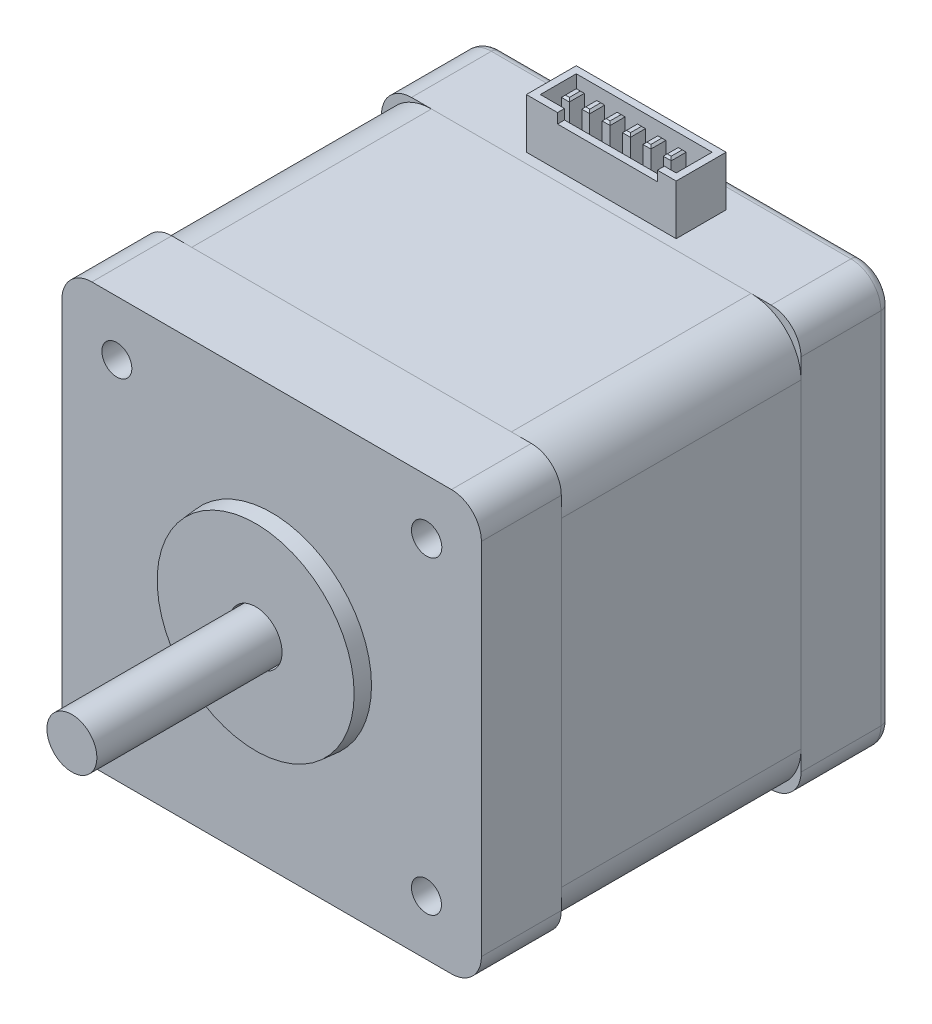
from build123d import *

# Parameters (mm, degrees)
SKETCH_1_R          = 1.5
EXTRUDE_1_DEPTH     = 8
SKETCH_4_R          = 2.5
EXTRUDE_2_DEPTH     = 20
SKETCH_9_W          = 42
SKETCH_9_H          = 42
EXTRUDE_7_DEPTH     = 24
SKETCH_10_W         = 42
SKETCH_10_H         = 42
EXTRUDE_8_DEPTH     = 9
FILLET_1_R          = 3
FILLET_2_R          = 5
SKETCH_12_R         = 1.5
SKETCH_12_R_2       = 1.518540069
CUT_EXTRUDE_1_DEPTH = 51.626080235
SKETCH_14_W         = 15
SKETCH_14_H         = 5
SKETCH_14_W_2       = 13.6
SKETCH_14_H_2       = 3.6
SKETCH_14_W_3       = 0.8
SKETCH_14_H_3       = 1.5
EXTRUDE_10_DEPTH    = 5
CHAMFER_1_SIZE      = 0.2
SKETCH_15_W         = 10
SKETCH_15_H         = 1
CUT_EXTRUDE_2_DEPTH = 0.7
FILLET_3_R          = 1
SKETCH_16_R         = 10
SKETCH_16_R_2       = 2.5
EXTRUDE_11_DEPTH    = 1.6
EXTRUDE_11_DRAFT    = 5
SKETCH_18_R         = 5
CUT_EXTRUDE_3_DEPTH = 3
EXTRUDE_START       = 2
SKETCH_19_R         = 2.5
EXTRUDE_13_DEPTH    = 2


with BuildPart() as part:
    # 草图1 → 凸台-拉伸1 (new body)
    with BuildSketch(Plane.XY):
        with BuildLine():
            Line((-18, 21), (18, 21))
            ThreePointArc((18, 21), (20.121320344, 20.121320344), (21, 18))
            Line((21, 18), (21, -18))
            ThreePointArc((21, -18), (20.121320344, -20.121320344), (18, -21))
            Line((18, -21), (-18, -21))
            ThreePointArc((-18, -21), (-20.121320344, -20.121320344), (-21, -18))
            Line((-21, -18), (-21, 18))
            ThreePointArc((-21, 18), (-20.121320344, 20.121320344), (-18, 21))
        make_face()
        with Locations((-15.5, 15.5)):
            Circle(SKETCH_1_R, mode=Mode.SUBTRACT)
        with Locations(Location((15.5, 15.5, 0), (0, 0, 180))):
            Circle(SKETCH_1_R, mode=Mode.SUBTRACT)
        with Locations((15.5, -15.5)):
            Circle(SKETCH_1_R, mode=Mode.SUBTRACT)
        with Locations(Location((-15.5, -15.5, 0), (0, 0, 180))):
            Circle(SKETCH_1_R, mode=Mode.SUBTRACT)
    extrude(amount=EXTRUDE_1_DEPTH)

    # 草图4 → 凸台-拉伸2 (add)
    with BuildSketch(Plane.XY.offset(8)):
        with Locations(Location((0, 0, 0), (0, 0, 180))):
            Circle(SKETCH_4_R)
    extrude(amount=EXTRUDE_2_DEPTH)


with BuildPart() as body_2:
    # 草图9 → 凸台-拉伸7 (new body)
    with BuildSketch(Plane(origin=(0, 0, 0), x_dir=(-1, 0, 0), z_dir=(0, 0, -1))):
        Rectangle(SKETCH_9_W, SKETCH_9_H)
    extrude(amount=EXTRUDE_7_DEPTH)

    # 圆角2
    fillet_2_edges = [body_2.edges().sort_by_distance(p)[0] for p in [
        (-21, -21, -12),
        (21, -21, -12),
        (21, 21, -12),
        (-21, 21, -12),
    ]]
    fillet(fillet_2_edges, radius=FILLET_2_R)


with BuildPart() as body_3:
    # 草图10 → 凸台-拉伸8 (new body)
    with BuildSketch(Plane(origin=(0, 0, -24), x_dir=(-1, 0, 0), z_dir=(0, 0, -1))):
        Rectangle(SKETCH_10_W, SKETCH_10_H)
    extrude(amount=EXTRUDE_8_DEPTH)

    # 圆角1
    fillet_1_edges = [body_3.edges().sort_by_distance(p)[0] for p in [
        (21, 21, -28.5),
        (-21, 21, -28.5),
        (-21, -21, -28.5),
        (21, -21, -28.5),
    ]]
    fillet(fillet_1_edges, radius=FILLET_1_R)


with BuildPart() as cut_extrude_1_tool:
    # 草图12 → 切除-拉伸1 (new, through all)
    with BuildSketch(Plane.XY.offset(8)):
        with Locations((-15.5, 15.5)):
            Circle(SKETCH_12_R)
        with Locations((15.518540069, 15.5)):
            Circle(SKETCH_12_R_2)
        with Locations((-15.5, -15.5)):
            Circle(SKETCH_12_R)
        with Locations((15.5, -15.5)):
            Circle(SKETCH_12_R)
    extrude(amount=-CUT_EXTRUDE_1_DEPTH)


with BuildPart() as part_1:
    add(part.part)

    # 切除-拉伸1: cut by cut_extrude_1_tool
    add(cut_extrude_1_tool.part, mode=Mode.SUBTRACT)


with BuildPart() as body_2_1:
    add(body_2.part)

    # 切除-拉伸1: cut by cut_extrude_1_tool
    add(cut_extrude_1_tool.part, mode=Mode.SUBTRACT)


with BuildPart() as body_3_1:
    add(body_3.part)

    # 切除-拉伸1: cut by cut_extrude_1_tool
    add(cut_extrude_1_tool.part, mode=Mode.SUBTRACT)

    # 草图14 → 凸台-拉伸10 (add)
    # profile 1 of 7: a face of its own
    with BuildSketch(Plane(origin=(0, 21, 0), x_dir=(1, 0, 0), z_dir=(0, 1, 0))):
        with Locations((0, 27.5)):
            Rectangle(SKETCH_14_W, SKETCH_14_H)
        with Locations((0, 27.5)):
            Rectangle(SKETCH_14_W_2, SKETCH_14_H_2, mode=Mode.SUBTRACT)
    # profile 2 of 7: a face of its own
    with BuildSketch(Plane(origin=(0, 21, 0), x_dir=(1, 0, 0), z_dir=(0, 1, 0))):
        with Locations((-5.3, 27.457329348)):
            Rectangle(SKETCH_14_W_3, SKETCH_14_H_3)
    # profile 3 of 7: a face of its own
    with BuildSketch(Plane(origin=(0, 21, 0), x_dir=(1, 0, 0), z_dir=(0, 1, 0))):
        with Locations((-1.22, 27.457329348)):
            Rectangle(SKETCH_14_W_3, SKETCH_14_H_3)
    # profile 4 of 7: a face of its own
    with BuildSketch(Plane(origin=(0, 21, 0), x_dir=(1, 0, 0), z_dir=(0, 1, 0))):
        with Locations((4.9, 27.457329348)):
            Rectangle(SKETCH_14_W_3, SKETCH_14_H_3)
    # profile 5 of 7: a face of its own
    with BuildSketch(Plane(origin=(0, 21, 0), x_dir=(1, 0, 0), z_dir=(0, 1, 0))):
        with Locations((2.86, 27.457329348)):
            Rectangle(SKETCH_14_W_3, SKETCH_14_H_3)
    # profile 6 of 7: a face of its own
    with BuildSketch(Plane(origin=(0, 21, 0), x_dir=(1, 0, 0), z_dir=(0, 1, 0))):
        with Locations((-3.26, 27.457329348)):
            Rectangle(SKETCH_14_W_3, SKETCH_14_H_3)
    # profile 7 of 7: a face of its own
    with BuildSketch(Plane(origin=(0, 21, 0), x_dir=(1, 0, 0), z_dir=(0, 1, 0))):
        with Locations((0.82, 27.457329348)):
            Rectangle(SKETCH_14_W_3, SKETCH_14_H_3)
    extrude(amount=EXTRUDE_10_DEPTH)

    # 倒角1
    chamfer_1_edges = [body_3_1.edges().sort_by_distance(p)[0] for p in [
        (5.3, 26, -27.457329348),
        (4.9, 26, -28.207329348),
        (4.5, 26, -27.457329348),
        (4.9, 26, -26.707329348),
        (3.26, 26, -27.457329348),
        (2.86, 26, -28.207329348),
        (2.46, 26, -27.457329348),
        (2.86, 26, -26.707329348),
        (-2.86, 26, -27.457329348),
        (-3.26, 26, -28.207329348),
        (-3.66, 26, -27.457329348),
        (-3.26, 26, -26.707329348),
        (1.22, 26, -27.457329348),
        (0.82, 26, -28.207329348),
        (0.42, 26, -27.457329348),
        (0.82, 26, -26.707329348),
        (-4.9, 26, -27.457329348),
        (-5.3, 26, -28.207329348),
        (-5.7, 26, -27.457329348),
        (-5.3, 26, -26.707329348),
        (-0.82, 26, -27.457329348),
        (-1.22, 26, -28.207329348),
        (-1.62, 26, -27.457329348),
        (-1.22, 26, -26.707329348),
    ]]
    chamfer(chamfer_1_edges, length=CHAMFER_1_SIZE)

    # 草图15 → 切除-拉伸2 (cut)
    with BuildSketch(Plane.XY.offset(-25)):
        with Locations((0.62, 25.5)):
            Rectangle(SKETCH_15_W, SKETCH_15_H)
    extrude(amount=-CUT_EXTRUDE_2_DEPTH, mode=Mode.SUBTRACT)

    # 圆角3
    fillet_3_edges = [body_3_1.edges().sort_by_distance(p)[0] for p in [
        (0, -21, -33),
        (21, 0, -33),
        (-21, 0, -33),
        (0, 21, -33),
        (20.121320344, 20.121320344, -33),
        (-20.121320344, 20.121320344, -33),
        (-20.121320344, -20.121320344, -33),
        (20.121320344, -20.121320344, -33),
    ]]
    fillet(fillet_3_edges, radius=FILLET_3_R)

    # 草图18 → 切除-拉伸3 (cut)
    with BuildSketch(Plane(origin=(0, 0, -33), x_dir=(-1, 0, 0), z_dir=(0, 0, -1))):
        Circle(SKETCH_18_R)
    extrude(amount=-CUT_EXTRUDE_3_DEPTH, mode=Mode.SUBTRACT)

    # 草图19 → 凸台-拉伸13 (add)
    with BuildSketch(Plane(origin=(0, 0, -30), x_dir=(-1, 0, 0), z_dir=(0, 0, -1)).offset(EXTRUDE_START)):
        Circle(SKETCH_19_R)
    extrude(amount=-EXTRUDE_13_DEPTH)


with BuildPart() as extrude_11_tool:
    # 草图16 → 凸台-拉伸11 (with draft: the straight prism first)
    with BuildSketch(Plane.XY.offset(8)):
        Circle(SKETCH_16_R)
        Circle(SKETCH_16_R_2, mode=Mode.SUBTRACT)
    extrude(amount=EXTRUDE_11_DEPTH)
    # 凸台-拉伸11: the draft: its side faces are tilted about the plane it starts from
    extrude_11_sides = [extrude_11_tool.faces().sort_by_distance(p)[0] for p in [
        (-10, 0, 8.8),
        (-2.5, 0, 8.8),
    ]]
    draft(extrude_11_sides, Plane.XY.offset(8), EXTRUDE_11_DRAFT)


with BuildPart() as part_2:
    add(part_1.part)

    # 凸台-拉伸11: add extrude_11_tool
    add(extrude_11_tool.part)


solid = Compound([body_2_1.part, body_3_1.part, part_2.part])
